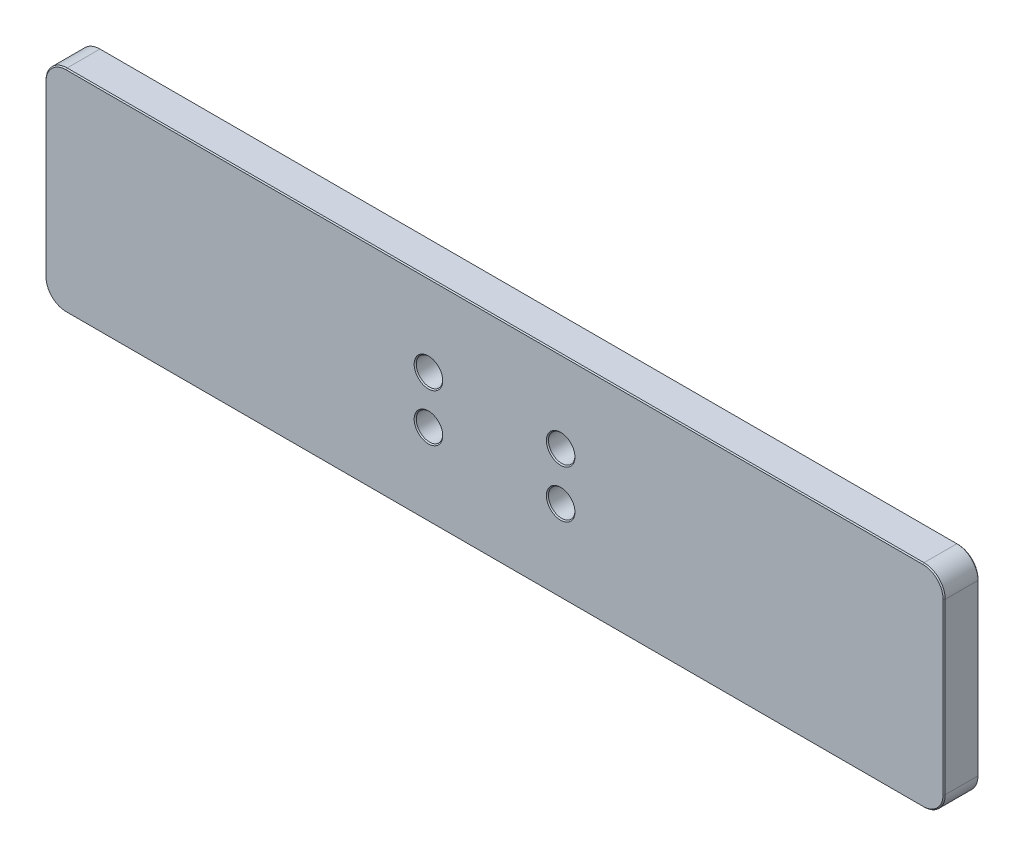
from build123d import *

# Parameters (mm, degrees)
SKETCH1_W           = 215.9
SKETCH1_H           = 50.8
SKETCH1_R           = 3.175
BOSS_EXTRUDE1_DEPTH = 8.382
FILLET1_R           = 5.08
CHAMFER1_SIZE       = 0.254


with BuildPart() as part:
    # Sketch1 → Boss-Extrude1 (new body)
    with BuildSketch(Plane.XY):
        Rectangle(SKETCH1_W, SKETCH1_H)
        with Locations((-15.875, 5.715)):
            Circle(SKETCH1_R, mode=Mode.SUBTRACT)
        with Locations((15.875, 5.715)):
            Circle(SKETCH1_R, mode=Mode.SUBTRACT)
        with Locations((15.875, -5.715)):
            Circle(SKETCH1_R, mode=Mode.SUBTRACT)
        with Locations((-15.875, -5.715)):
            Circle(SKETCH1_R, mode=Mode.SUBTRACT)
    extrude(amount=BOSS_EXTRUDE1_DEPTH)

    # Fillet1
    fillet1_edges = [part.edges().sort_by_distance(p)[0] for p in [
        (-107.95, 25.4, 4.191),
        (107.95, 25.4, 4.191),
        (107.95, -25.4, 4.191),
        (-107.95, -25.4, 4.191),
    ]]
    fillet(fillet1_edges, radius=FILLET1_R)

    # Chamfer1
    chamfer1_edges = [part.edges().sort_by_distance(p)[0] for p in [
        (-19.05, 5.715, 0),
        (-19.05, 5.715, 8.382),
        (12.7, 5.715, 0),
        (12.7, 5.715, 8.382),
        (12.7, -5.715, 0),
        (12.7, -5.715, 8.382),
        (-19.05, -5.715, 0),
        (-19.05, -5.715, 8.382),
        (0, -25.4, 0),
        (0, -25.4, 8.382),
        (-107.95, 0, 0),
        (0, 25.4, 0),
        (107.95, 0, 0),
        (-106.462102448, 23.912102448, 0),
        (106.462102448, 23.912102448, 0),
        (106.462102448, -23.912102448, 0),
        (-106.462102448, -23.912102448, 0),
        (-107.95, 0, 8.382),
        (107.95, 0, 8.382),
        (0, 25.4, 8.382),
        (-106.462102448, 23.912102448, 8.382),
        (106.462102448, 23.912102448, 8.382),
        (106.462102448, -23.912102448, 8.382),
        (-106.462102448, -23.912102448, 8.382),
    ]]
    chamfer(chamfer1_edges, length=CHAMFER1_SIZE)


solid = part.part
